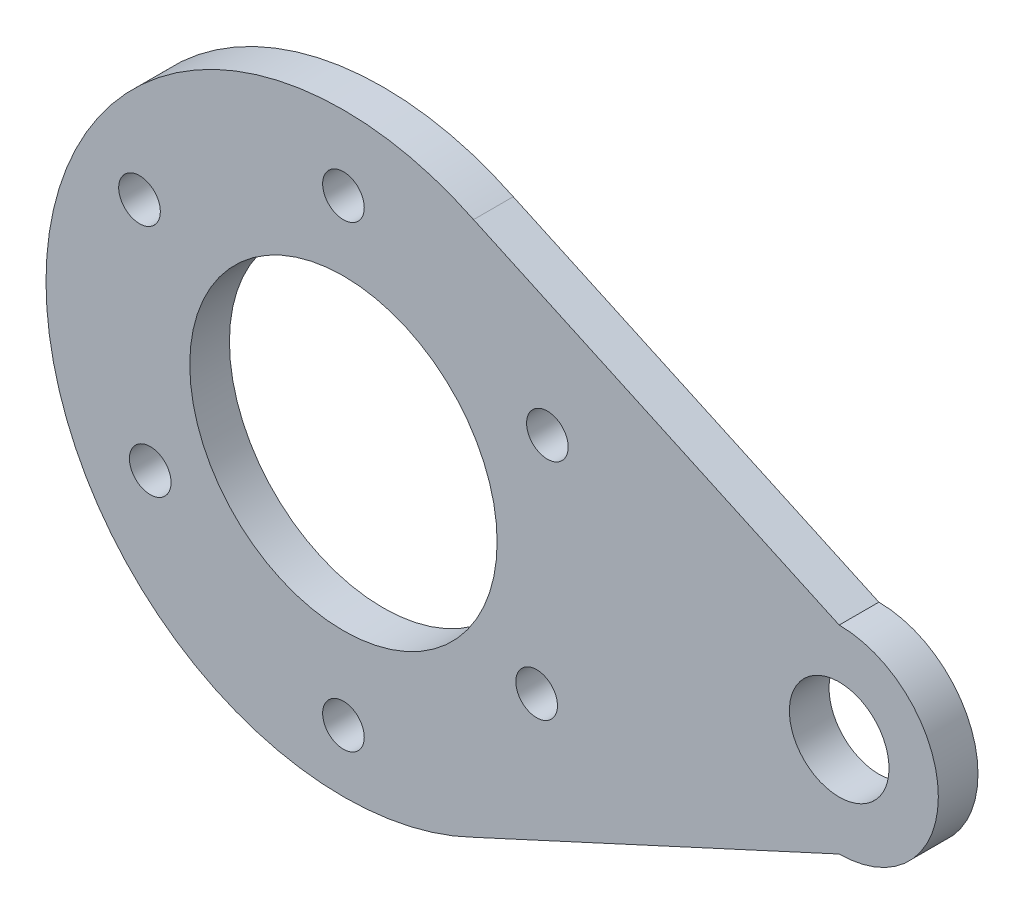
from build123d import *

# Parameters (mm, degrees)
SKETCH_2_R      = 2.1
SKETCH_2_R_2    = 15.5
SKETCH_2_R_3    = 5.025
EXTRUDE_1_DEPTH = 4


with BuildPart() as part:
    # 草图2 → 凸台-拉伸1 (new body)
    with BuildSketch(Plane.XY):
        with BuildLine():
            Line((52.574074367, 4.472412166), (15.699074367, 21.448964484))
            ThreePointArc((15.699074367, 21.448964484), (-27.425925633, -5.527587834), (15.699074367, -32.504140153))
            Line((15.699074367, -32.504140153), (52.574074367, -15.527587834))
            ThreePointArc((52.574074367, -15.527587834), (62.574074367, -5.527587834), (52.574074367, 4.472412166))
        make_face()
        with Locations((2.574074367, -29.277587834)):
            Circle(SKETCH_2_R, mode=Mode.SUBTRACT)
        with Locations((22.059645952, -16.777587834)):
            Circle(SKETCH_2_R, mode=Mode.SUBTRACT)
        with Locations((2.574074367, -5.527587834)):
            Circle(SKETCH_2_R_2, mode=Mode.SUBTRACT)
        with Locations((52.574074367, -5.527587834)):
            Circle(SKETCH_2_R_3, mode=Mode.SUBTRACT)
        with Locations((-17.994028973, 6.347412166)):
            Circle(SKETCH_2_R, mode=Mode.SUBTRACT)
        with Locations((23.142177707, 6.347412166)):
            Circle(SKETCH_2_R, mode=Mode.SUBTRACT)
        with Locations((2.574074367, 16.972412166)):
            Circle(SKETCH_2_R, mode=Mode.SUBTRACT)
        with Locations((-16.911497218, -16.777587834)):
            Circle(SKETCH_2_R, mode=Mode.SUBTRACT)
    extrude(amount=EXTRUDE_1_DEPTH)


solid = part.part
